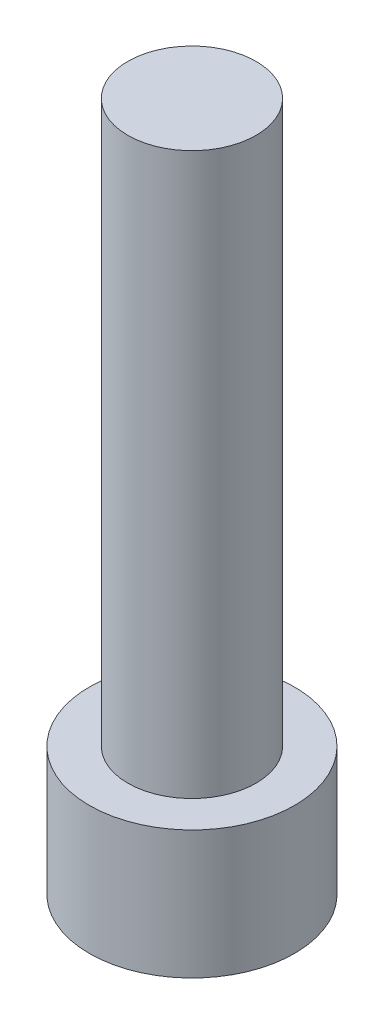
from build123d import *

# Parameters (mm, degrees)
SKETCH_2_R          = 6.4
EXTRUDE_1_DEPTH     = 8
CUT_EXTRUDE_2_DEPTH = 6
SKETCH_4_R          = 4
EXTRUDE_3_DEPTH     = 35


with BuildPart() as part:
    # Эскиз2 → Вытянуть1 (new body)
    with BuildSketch(Plane(origin=(0, 0, 0), x_dir=(1, 0, 0), z_dir=(0, 1, 0))):
        with Locations(Location((0, 0, 0), (0, 0, 270))):
            Circle(SKETCH_2_R)
    extrude(amount=EXTRUDE_1_DEPTH)

    # Эскиз3 → Вытянуть2 (cut)
    with BuildSketch(Plane.XZ):
        Polygon((-1.64328585, -4.006196652), (2.647825149, -3.426225618), (4.291110998, 0.579971035), (1.64328585, 4.006196652), (-2.647825149, 3.426225618), (-4.291110998, -0.579971035), align=None)
    extrude(amount=-CUT_EXTRUDE_2_DEPTH, mode=Mode.SUBTRACT)

    # Эскиз4 → Вытянуть3 (add)
    with BuildSketch(Plane(origin=(0, 8, 0), x_dir=(-1, 0, 0), z_dir=(0, 1, 0))):
        with Locations(Location((0, 0, 0), (0, 0, 90))):
            Circle(SKETCH_4_R)
    extrude(amount=EXTRUDE_3_DEPTH)


solid = part.part
